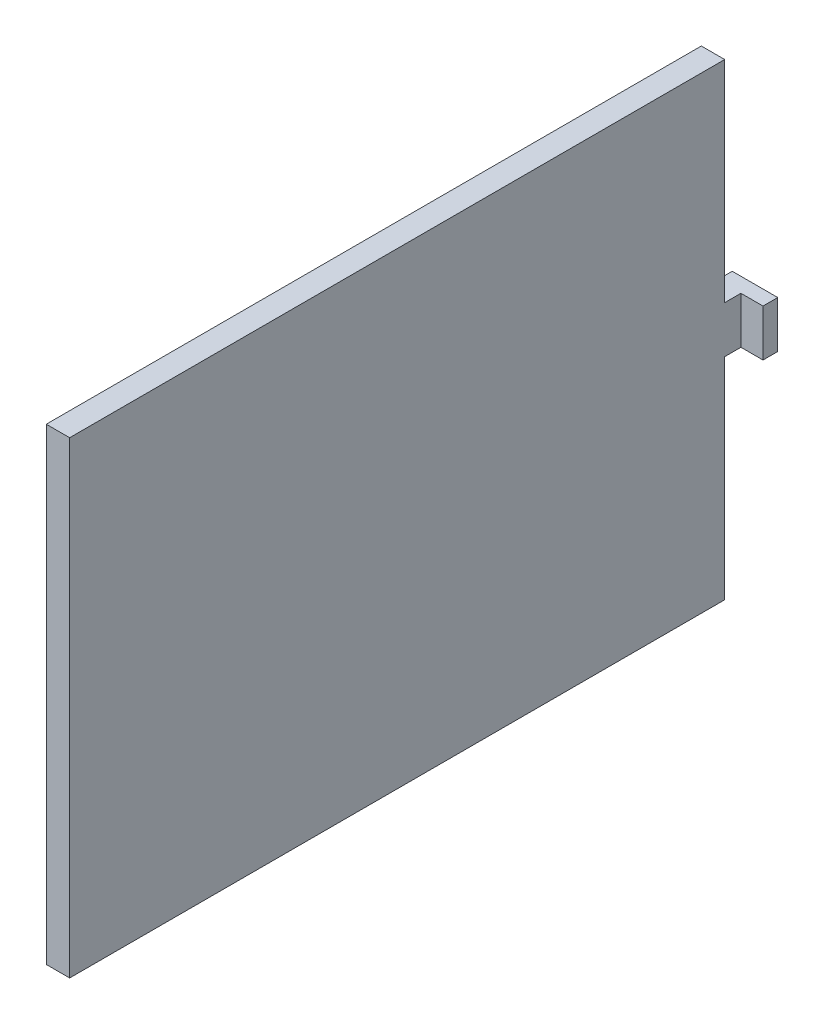
from build123d import *

# Parameters (mm, degrees)
SKETCH1_W           = 3.175
SKETCH1_H           = 63.5
BOSS_EXTRUDE1_DEPTH = 88.9
BOSS_EXTRUDE2_DEPTH = 3.175


with BuildPart() as part:
    # Sketch1 → Boss-Extrude1 (new body)
    with BuildSketch(Plane.XY):
        Rectangle(SKETCH1_W, SKETCH1_H)
    extrude(amount=BOSS_EXTRUDE1_DEPTH)

    # Sketch2 → Boss-Extrude2 (add, symmetric)
    with BuildSketch(Plane(origin=(0, 0, 0), x_dir=(1, 0, 0), z_dir=(0, 1, 0))):
        Polygon((1.5875, 0), (1.5875, 2.2), (4.5847, 2.2), (4.5847, 4.2), (-1.5875, 4.2), (-1.5875, 0), align=None)
    extrude(amount=BOSS_EXTRUDE2_DEPTH, both=True)


solid = part.part
